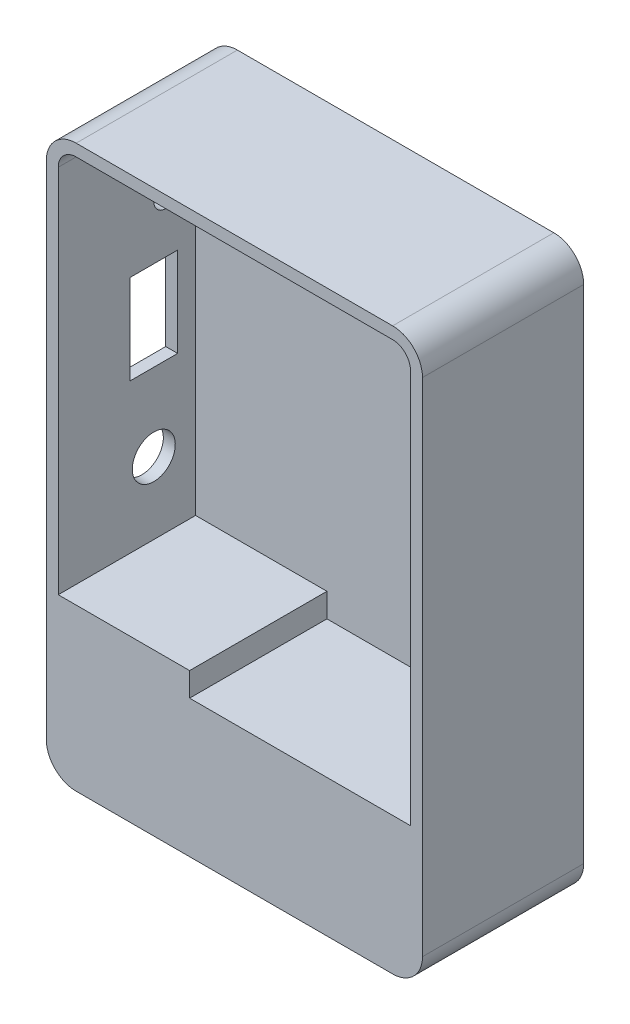
from build123d import *

# Parameters (mm, degrees)
BOSS_EXTRU_1_DEPTH      = 27
ESQUISSE2_R             = 3.6
ESQUISSE2_W             = 8
ESQUISSE2_H             = 15
ENL_V_MAT_EXTRU_1_DEPTH = 9
ESQUISSE3_W             = 16
ESQUISSE3_H             = 14
ESQUISSE3_W_2           = 15
ESQUISSE3_H_2           = 16
ENL_V_MAT_EXTRU_2_DEPTH = 19
ENL_V_MAT_EXTRU_3_DEPTH = 23


with BuildPart() as part:
    # Esquisse1 → Boss.-Extru.1 (new body)
    with BuildSketch(Plane.XY):
        with BuildLine():
            Line((5, 0), (58, 0))
            ThreePointArc((58, 0), (61.535533906, 1.464466094), (63, 5))
            Line((63, 5), (63, 89))
            ThreePointArc((63, 89), (61.535533906, 92.535533906), (58, 94))
            Line((58, 94), (5, 94))
            ThreePointArc((5, 94), (1.464466094, 92.535533906), (0, 89))
            Line((0, 89), (0, 5))
            ThreePointArc((0, 5), (1.464466094, 1.464466094), (5, 0))
        make_face()
    extrude(amount=BOSS_EXTRU_1_DEPTH)

    # Esquisse2 → Enlèv. mat.-Extru.1 (cut)
    with BuildSketch(Plane.ZY):
        with Locations(Location((11, 39, 0), (0, 0, 270))):
            Circle(ESQUISSE2_R)
        with BuildLine():
            Line((11, 84), (11, 76))
            ThreePointArc((11, 76), (9, 74), (7, 76))
            Line((7, 76), (7, 84))
            ThreePointArc((7, 84), (9, 86), (11, 84))
        make_face()
        with Locations((11, 59.5)):
            Rectangle(ESQUISSE2_W, ESQUISSE2_H)
    extrude(amount=-ENL_V_MAT_EXTRU_1_DEPTH, mode=Mode.SUBTRACT)

    # Esquisse3 → Enlèv. mat.-Extru.2 (cut)
    with BuildSketch(Plane.XZ):
        with Locations((13, 15)):
            Rectangle(ESQUISSE3_W, ESQUISSE3_H)
        with Locations((31.5, 16)):
            Rectangle(ESQUISSE3_W_2, ESQUISSE3_H_2)
        with Locations((49.5, 16)):
            Rectangle(ESQUISSE3_W_2, ESQUISSE3_H_2)
    extrude(amount=-ENL_V_MAT_EXTRU_2_DEPTH, mode=Mode.SUBTRACT)

    # Esquisse4 → Enlèv. mat.-Extru.3 (cut)
    with BuildSketch(Plane.XY.offset(27)):
        with BuildLine():
            Line((2, 27), (24, 27))
            Line((24, 27), (24, 23))
            Line((24, 23), (61, 23))
            Line((61, 23), (61, 27))
            Line((61, 27), (61, 89))
            ThreePointArc((61, 89), (60.121320344, 91.121320344), (58, 92))
            Line((58, 92), (5, 92))
            ThreePointArc((5, 92), (2.878679656, 91.121320344), (2, 89))
            Line((2, 89), (2, 27))
        make_face()
    extrude(amount=-ENL_V_MAT_EXTRU_3_DEPTH, mode=Mode.SUBTRACT)


solid = part.part
